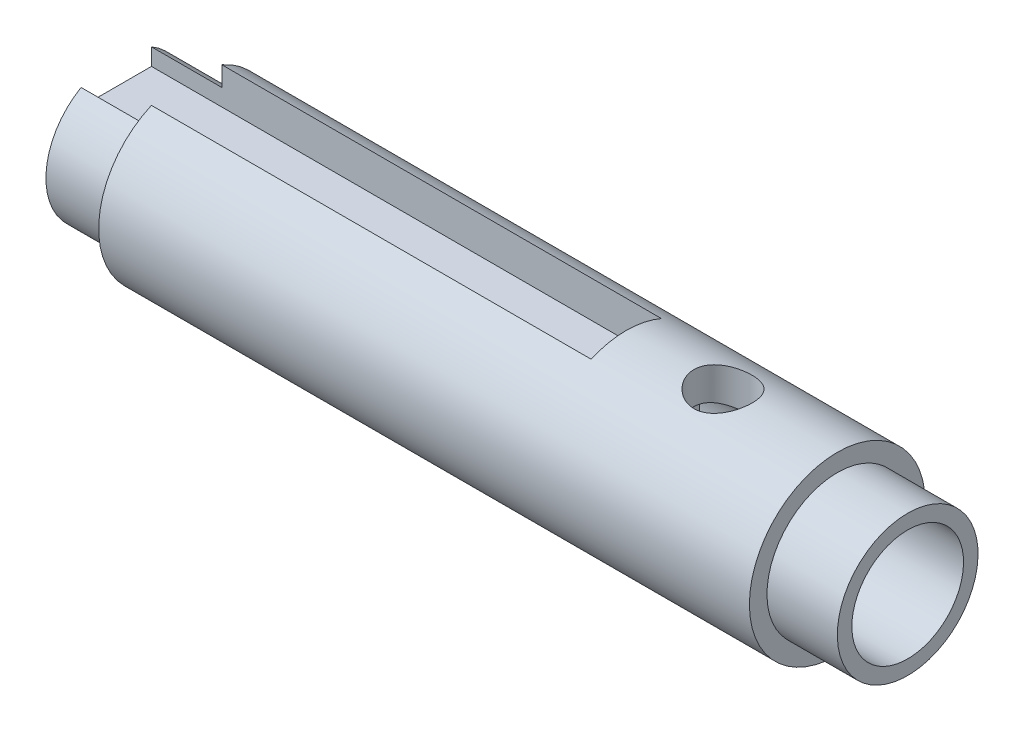
from build123d import *

# Parameters (mm, degrees)
SKETCH3_R                 = 3.175
CUT_EXTRUDE2_DEPTH        = 15
M4X0_7_TAPPED_HOLE1_D     = 3.3
M4X0_7_TAPPED_HOLE1_DEPTH = 7
M4X0_7_TAPPED_HOLE1_TIP   = 0.991420021
KEY_CUT_DEPTH             = 25
KEY_CUT_DEPTH_BACK        = 25


with BuildPart() as part:
    # Sketch1 → Revolve1 (revolve)
    with BuildSketch(Plane.XY):
        Polygon((-22.5, 0), (-22.5, 4), (-18.5, 4), (-18.5, 5), (18.5, 5), (18.5, 4), (22.5, 4), (22.5, 0), align=None)
    revolve(axis=Axis((22.5, 0, 0), (-1, 0, 0)))

    # Sketch3 → Cut-Extrude2 (cut)
    with BuildSketch(Plane(origin=(22.5, 0, 0), x_dir=(0, 0, -1), z_dir=(1, 0, 0))):
        with Locations(Location((0, 0, 0), (0, 0, 90))):
            Circle(SKETCH3_R)
    extrude(amount=-CUT_EXTRUDE2_DEPTH, mode=Mode.SUBTRACT)

    # M4x0.7 Tapped Hole1
    with Locations(Plane(origin=(0, 5, 0), x_dir=(1, 0, 0), z_dir=(0, 1, 0))):
        with Locations((12, 0)):
            Hole(M4X0_7_TAPPED_HOLE1_D / 2, depth=M4X0_7_TAPPED_HOLE1_DEPTH)
            with Locations((0, 0, -(M4X0_7_TAPPED_HOLE1_DEPTH + M4X0_7_TAPPED_HOLE1_TIP / 2))):  # 118° drill point
                Cone(0, M4X0_7_TAPPED_HOLE1_D / 2, M4X0_7_TAPPED_HOLE1_TIP, mode=Mode.SUBTRACT)

    # Sketch7 → Key Cut (cut, two sides: drawn at the far end of the back side and taken through both)
    with BuildSketch(Plane.ZY.offset(18.5).offset(-KEY_CUT_DEPTH_BACK)):
        with BuildLine():
            ThreePointArc((-2, 3.464101615), (0, 4), (2, 3.464101615))
            Line((2, 3.464101615), (2, 4.582575695))
            ThreePointArc((2, 4.582575695), (1.021548206, 4.894531567), (-2.5e-08, 5))
            ThreePointArc((-2.5e-08, 5), (-1.021548231, 4.894531562), (-2, 4.582575695))
            Line((-2, 4.582575695), (-2, 3.464101615))
        make_face()
        with BuildLine():
            Line((-2, 2.5), (2, 2.5))
            Line((2, 2.5), (2, 3.464101615))
            ThreePointArc((2, 3.464101615), (0, 4), (-2, 3.464101615))
            Line((-2, 3.464101615), (-2, 2.5))
        make_face()
    extrude(amount=KEY_CUT_DEPTH + KEY_CUT_DEPTH_BACK, mode=Mode.SUBTRACT)


solid = part.part
